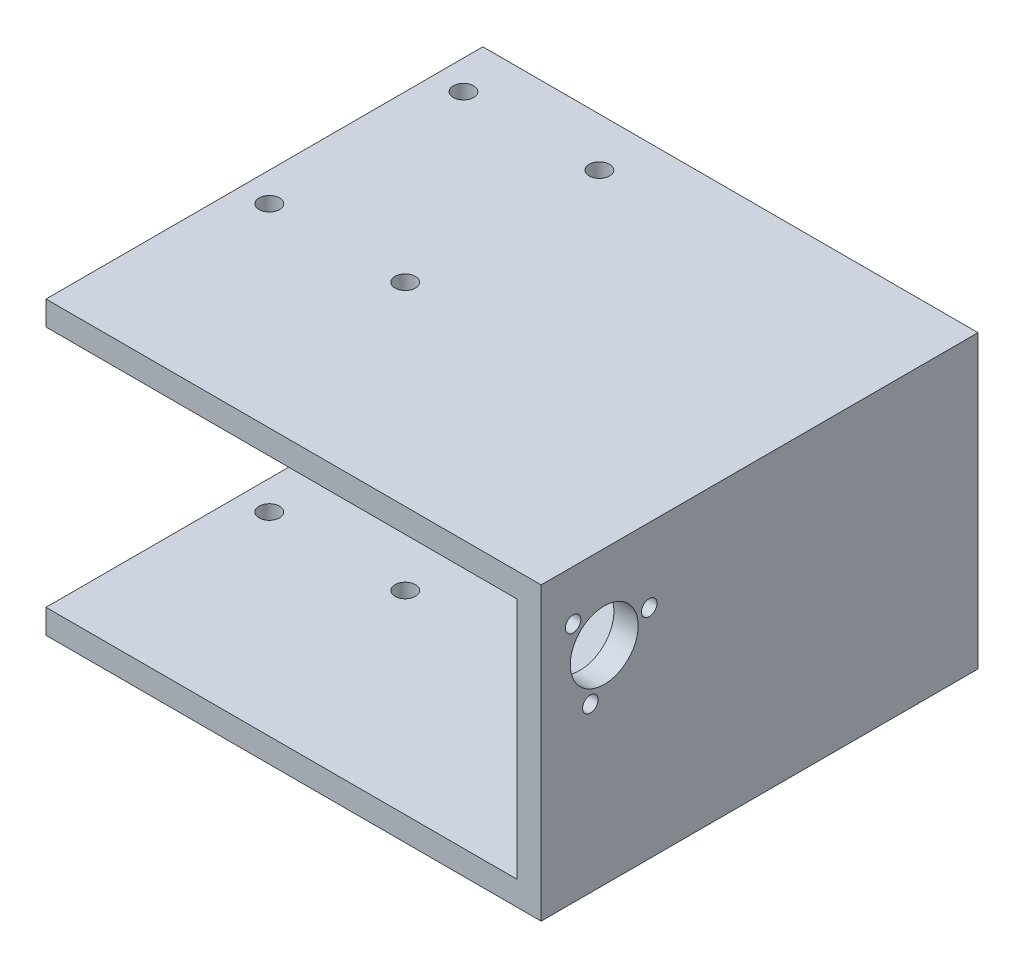
from build123d import *

# Parameters (mm, degrees)
EXTRUDE_1_DEPTH          = 90
CUT_EXTRUDE1_DEPTH       = 147.727638841
CUT_EXTRUDE1_DEPTH_BACK  = 147.727638841
SKETCH1_R                = 2.1
SKETCH_2_R               = 7
CUT_EXTRUDE_1_DEPTH      = 10
SKETCH_6_R               = 1.6
CUT_EXTRUDE_3_DEPTH      = 10
PATTERN_CIRCULAR_1_COUNT = 3


with BuildPart() as part:
    # 草图1 → 凸台-拉伸1 (new body)
    with BuildSketch(Plane.XY):
        Polygon((0, 0), (0, 5), (102, 5), (102, -55), (0, -55), (0, -50), (97, -50), (97, 0), align=None)
    extrude(amount=EXTRUDE_1_DEPTH)

    # Sketch1 → Cut-Extrude1 (cut, two sides: drawn at the far end of the back side and taken through both)
    with BuildSketch(Plane(origin=(0, 0, 0), x_dir=(1, 0, 0), z_dir=(0, 1, 0)).offset(-CUT_EXTRUDE1_DEPTH_BACK)):
        with Locations(Location((6, -10, 0), (0, 0, 270))):
            Circle(SKETCH1_R)
        with Locations(Location((34, -10, 0), (0, 0, 270))):
            Circle(SKETCH1_R)
        with Locations(Location((34, -50, 0), (0, 0, 270))):
            Circle(SKETCH1_R)
        with Locations(Location((6, -50, 0), (0, 0, 270))):
            Circle(SKETCH1_R)
    extrude(amount=CUT_EXTRUDE1_DEPTH + CUT_EXTRUDE1_DEPTH_BACK, mode=Mode.SUBTRACT)

    # 草图2 → 切除-拉伸1 (cut)
    with BuildSketch(Plane.ZY.offset(-97)):
        with Locations((77, -12.25)):
            Circle(SKETCH_2_R)
    extrude(amount=-CUT_EXTRUDE_1_DEPTH, mode=Mode.SUBTRACT)

    # 草图6 → 切除-拉伸3 (cut)
    with BuildSketch(Plane(origin=(102, 0, 0), x_dir=(0, 0, -1), z_dir=(1, 0, 0))):
        with Locations((-83.421648209, -5.249111894)):
            Circle(SKETCH_6_R)
    cut_extrude_3 = extrude(amount=-CUT_EXTRUDE_3_DEPTH, mode=Mode.SUBTRACT)

    # 阵列(圆周)1: 切除-拉伸3 ×3 about axis
    pattern_circular_1_axis = Axis((0, -12.25, 77), (1, 0, 0))
    for i in range(1, PATTERN_CIRCULAR_1_COUNT):
        add(cut_extrude_3.rotate(pattern_circular_1_axis, i * 360 / PATTERN_CIRCULAR_1_COUNT), mode=Mode.SUBTRACT)


solid = part.part
